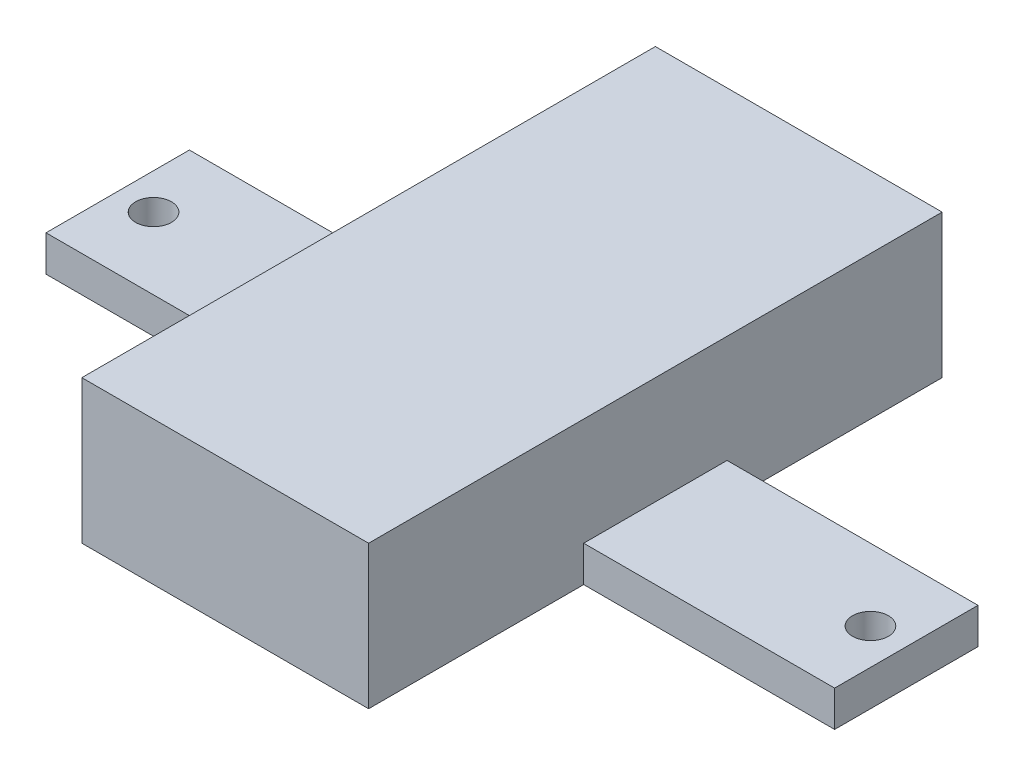
from build123d import *

# Parameters (mm, degrees)
SKETCH2_W           = 69.85
SKETCH2_H           = 3.175
BOSS_EXTRUDE1_DEPTH = 6.35
SKETCH5_W           = 25.4
SKETCH5_H           = 12.7
BOSS_EXTRUDE2_DEPTH = 25.4
SKETCH6_R           = 1.5875
CUT_EXTRUDE1_DEPTH  = 45.22263278


with BuildPart() as part:
    # Sketch2 → Boss-Extrude1 (new, symmetric)
    with BuildSketch(Plane.XY):
        Rectangle(SKETCH2_W, SKETCH2_H)
    extrude(amount=BOSS_EXTRUDE1_DEPTH, both=True)

    # Sketch5 → Boss-Extrude2 (add, symmetric)
    with BuildSketch(Plane.XY):
        with Locations((0, 4.7625)):
            Rectangle(SKETCH5_W, SKETCH5_H)
    extrude(amount=BOSS_EXTRUDE2_DEPTH, both=True)

    # Sketch6 → Cut-Extrude1 (cut, through all)
    with BuildSketch(Plane(origin=(0, 1.5875, 0), x_dir=(1, 0, 0), z_dir=(0, 1, 0))):
        with Locations(Location((-31.75, 0, 0), (0, 0, 270))):
            Circle(SKETCH6_R)
        with Locations(Location((31.75, 0, 0), (0, 0, 270))):
            Circle(SKETCH6_R)
    extrude(amount=-CUT_EXTRUDE1_DEPTH, mode=Mode.SUBTRACT)


solid = part.part
